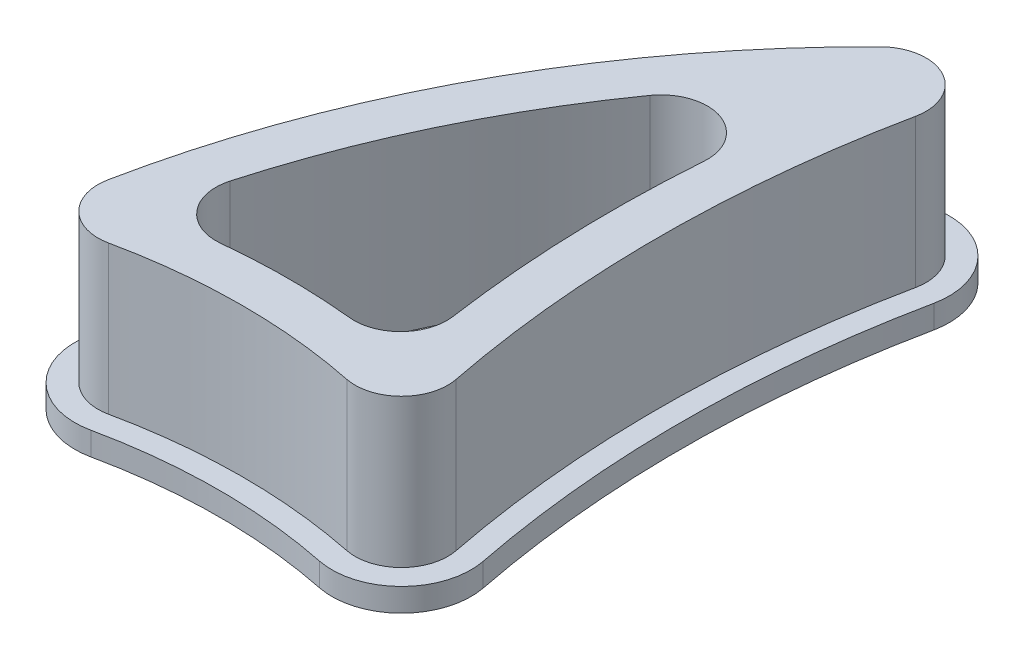
from build123d import *

# Parameters (mm, degrees)
EXTRUDE_1_DEPTH = 6.4
EXTRUDE_START   = 1
EXTRUDE_2_DEPTH = 1


with BuildPart() as part:
    # 草图1 → 凸台-拉伸1 (new body)
    with BuildSketch(Plane(origin=(0, 0, 0), x_dir=(1, 0, 0), z_dir=(0, 1, 0))):
        with BuildLine():
            ThreePointArc((9.408322903, -18.959036044), (8.462947609, -9.075455108), (9.489133957, 0.800062505))
            ThreePointArc((9.489133957, 0.800062505), (8.485051884, 2.960605743), (6.126001815, 2.627423116))
            ThreePointArc((6.126001815, 2.627423116), (-1.335637062, -7.312092102), (-5.56165784, -19.000152929))
            ThreePointArc((-5.56165784, -19.000152929), (-5.00663777, -20.817073781), (-3.183209091, -21.350324671))
            ThreePointArc((-3.183209091, -21.350324671), (1.928862639, -20.799262541), (7.045551036, -21.305668207))
            ThreePointArc((7.045551036, -21.305668207), (8.855513245, -20.765251632), (9.408322903, -18.959036044))
        make_face()
        with BuildLine():
            ThreePointArc((2.976756237, -4.154153602), (-0.47609237, -10.031864801), (-2.880753578, -16.410521158))
            ThreePointArc((-2.880753578, -16.410521158), (-2.48632099, -18.241682979), (-0.749525833, -18.943304858))
            ThreePointArc((-0.749525833, -18.943304858), (2.027828599, -18.799026213), (4.80529101, -18.941211027))
            ThreePointArc((4.80529101, -18.941211027), (6.452405298, -18.337478004), (6.989988212, -16.667602665))
            ThreePointArc((6.989988212, -16.667602665), (6.493452286, -11.07299147), (6.603213721, -5.457461684))
            ThreePointArc((6.603213721, -5.457461684), (5.285045054, -3.428301943), (2.976756237, -4.154153602))
        make_face(mode=Mode.SUBTRACT)
    extrude(amount=EXTRUDE_1_DEPTH)

    # 草图2 → 凸台-拉伸2 (add)
    with BuildSketch(Plane.XZ.offset(EXTRUDE_START)):
        with BuildLine():
            ThreePointArc((5.423903654, -3.339503289), (8.962478758, -3.839277229), (10.468601867, -0.598462372))
            ThreePointArc((10.468601867, -0.598462372), (9.462939246, 9.079544889), (10.389407034, 18.765454206))
            ThreePointArc((10.389407034, 18.765454206), (9.560192546, 21.474777588), (6.845249234, 22.285402451))
            ThreePointArc((6.845249234, 22.285402451), (1.933228373, 21.799253011), (-2.974360489, 22.328272656))
            ThreePointArc((-2.974360489, 22.328272656), (-5.709503507, 21.528396321), (-6.542033612, 18.803015043))
            ThreePointArc((-6.542033612, 18.803015043), (-2.215393291, 6.836667054), (5.423903654, -3.339503289))
        make_face()
        with BuildLine():
            ThreePointArc((2.976756237, 4.154153602), (5.285045054, 3.428301943), (6.603213721, 5.457461684))
            ThreePointArc((6.603213721, 5.457461684), (6.493452286, 11.07299147), (6.989988212, 16.667602665))
            ThreePointArc((6.989988212, 16.667602665), (6.452405298, 18.337478004), (4.80529101, 18.941211027))
            ThreePointArc((4.80529101, 18.941211027), (2.027828599, 18.799026213), (-0.749525833, 18.943304858))
            ThreePointArc((-0.749525833, 18.943304858), (-2.48632099, 18.241682979), (-2.880753578, 16.410521158))
            ThreePointArc((-2.880753578, 16.410521158), (-0.47609237, 10.031864801), (2.976756237, 4.154153602))
        make_face(mode=Mode.SUBTRACT)
    extrude(amount=-EXTRUDE_2_DEPTH)


solid = part.part
